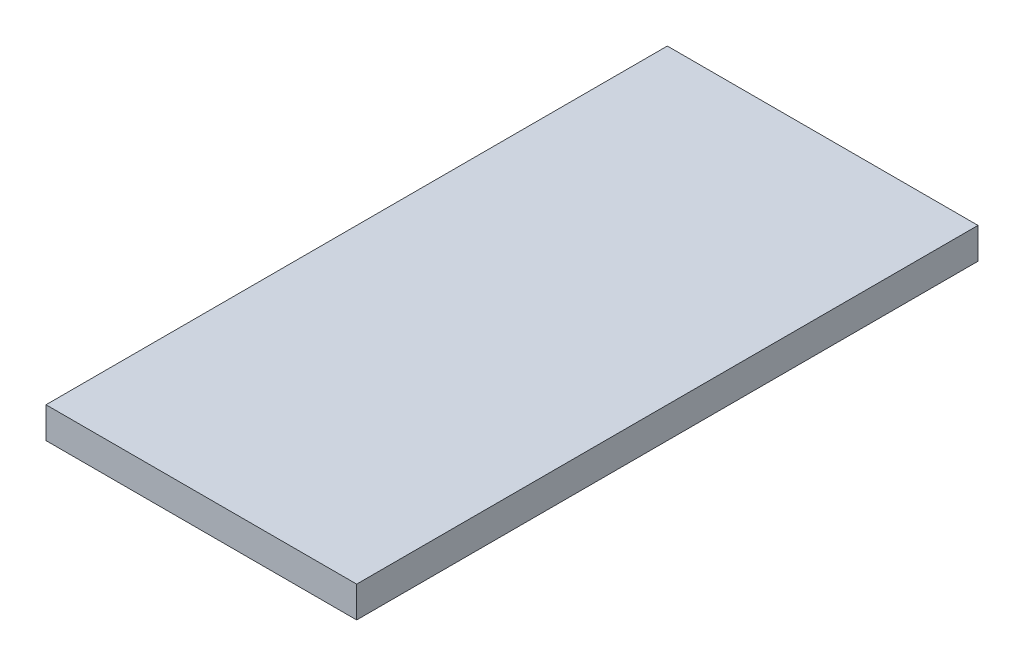
from build123d import *

# Parameters (mm, degrees)
SKETCH1_W           = 100
SKETCH1_H           = 200
BOSS_EXTRUDE1_DEPTH = 10


with BuildPart() as part:
    # Sketch1 → Boss-Extrude1 (new body)
    with BuildSketch(Plane(origin=(0, 0, 0), x_dir=(1, 0, 0), z_dir=(0, 1, 0))):
        Rectangle(SKETCH1_W, SKETCH1_H)
    extrude(amount=BOSS_EXTRUDE1_DEPTH)


solid = part.part
